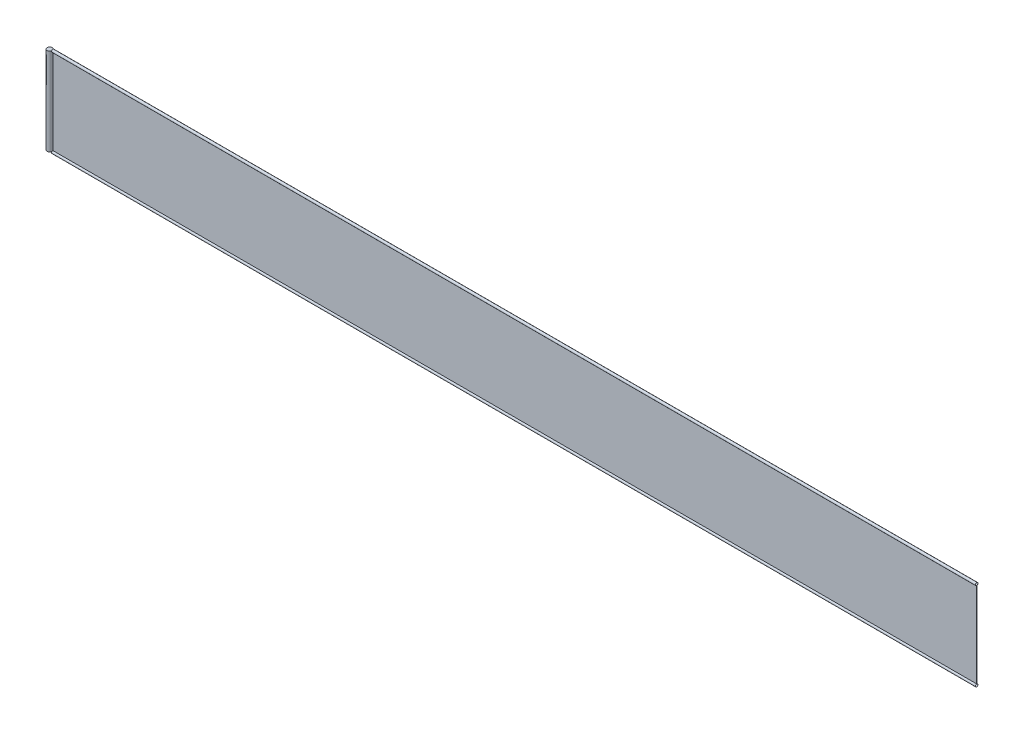
from build123d import *

# Parameters (mm, degrees)
BOSS_EXTRUDE1_START = -2050
SKETCH1_R           = 120
BOSS_EXTRUDE1_DEPTH = 4100
BOSS_EXTRUDE2_START = -1.5
SKETCH2_W           = 43375.848153551
SKETCH2_H           = 4000
BOSS_EXTRUDE2_DEPTH = 3
BOSS_EXTRUDE3_START = 1449.28989768
SKETCH3_R           = 60
SKETCH3_R_2         = 57
BOSS_EXTRUDE3_DEPTH = 43375.848153551
BOSS_EXTRUDE4_START = 1449.28989768
SKETCH4_R           = 60
SKETCH4_R_2         = 57
BOSS_EXTRUDE4_DEPTH = 43375.848153551


with BuildPart() as part:
    # Sketch1 → Boss-Extrude1 (new body)
    with BuildSketch(Plane(origin=(0, 0, 0), x_dir=(1, 0, 0), z_dir=(0, 1, 0)).offset(BOSS_EXTRUDE1_START)):
        with Locations(Location((1299.28989768, 0, 0), (0, 0, 270))):
            Circle(SKETCH1_R)
    extrude(amount=BOSS_EXTRUDE1_DEPTH)


with BuildPart() as body_2:
    # Sketch2 → Boss-Extrude2 (new body)
    with BuildSketch(Plane.XY.offset(BOSS_EXTRUDE2_START)):
        with Locations((23137.213974456, 0)):
            Rectangle(SKETCH2_W, SKETCH2_H)
    extrude(amount=BOSS_EXTRUDE2_DEPTH)


with BuildPart() as body_3:
    # Sketch3 → Boss-Extrude3 (new body)
    with BuildSketch(Plane(origin=(0, 0, 0), x_dir=(0, 0, -1), z_dir=(1, 0, 0)).offset(BOSS_EXTRUDE3_START)):
        with Locations((0, -2060)):
            Circle(SKETCH3_R)
        with Locations((0, -2060)):
            Circle(SKETCH3_R_2, mode=Mode.SUBTRACT)
    extrude(amount=BOSS_EXTRUDE3_DEPTH)


with BuildPart() as body_4:
    # Sketch4 → Boss-Extrude4 (new body)
    with BuildSketch(Plane(origin=(0, 0, 0), x_dir=(0, 0, -1), z_dir=(1, 0, 0)).offset(BOSS_EXTRUDE4_START)):
        with Locations((0, 2060)):
            Circle(SKETCH4_R)
        with Locations((0, 2060)):
            Circle(SKETCH4_R_2, mode=Mode.SUBTRACT)
    extrude(amount=BOSS_EXTRUDE4_DEPTH)


solid = Compound([part.part, body_2.part, body_3.part, body_4.part])
